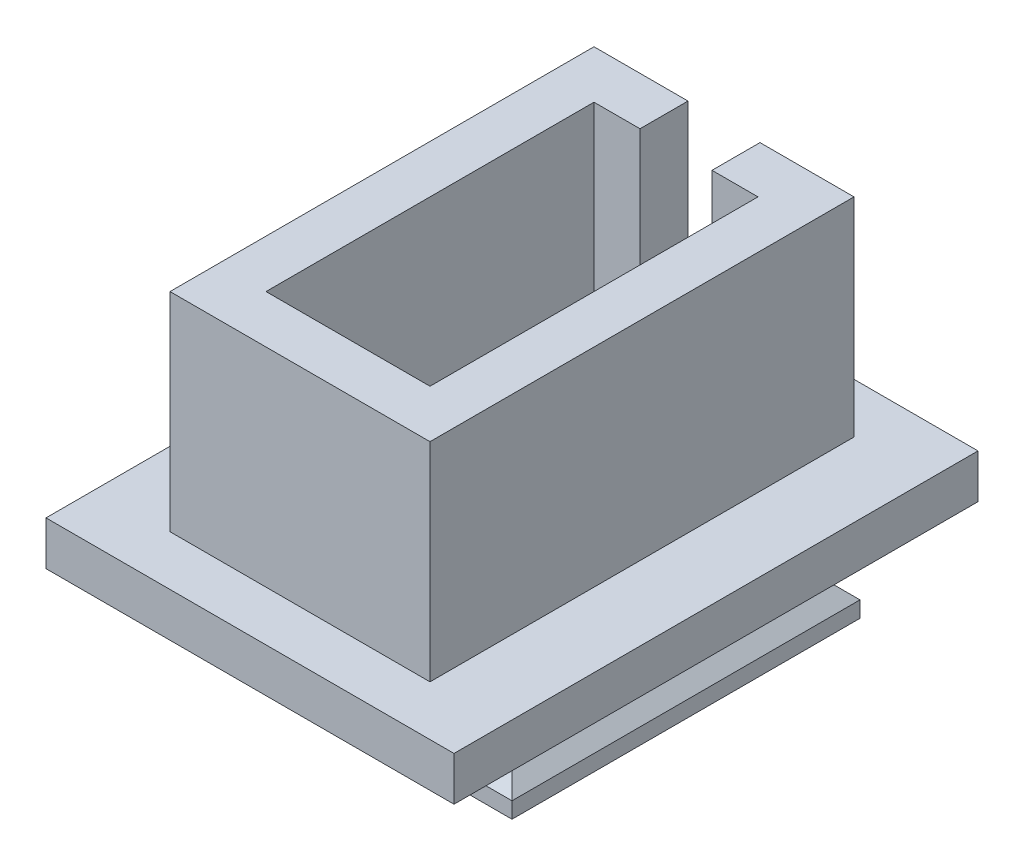
from build123d import *

# Parameters (mm, degrees)
SKETCH1_W           = 43.5
SKETCH1_H           = 43.5
BOSS_EXTRUDE1_DEPTH = 2
SKETCH2_W           = 43.5
SKETCH2_H           = 43.5
BOSS_EXTRUDE3_DEPTH = 7
CUT_EXTRUDE1_DEPTH  = 53.350416735
CUT_EXTRUDE2_DEPTH  = 52.039681144
SKETCH7_W           = 51
SKETCH7_H           = 65.5
BOSS_EXTRUDE4_DEPTH = 5.5
BOSS_EXTRUDE5_DEPTH = 26


with BuildPart() as part:
    # Sketch1 → Boss-Extrude1 (new body)
    with BuildSketch(Plane(origin=(0, 0, 0), x_dir=(1, 0, 0), z_dir=(0, 1, 0))):
        with Locations((-5.950471698, -3.385613208)):
            Rectangle(SKETCH1_W, SKETCH1_H)
    extrude(amount=BOSS_EXTRUDE1_DEPTH)


with BuildPart() as body_2:
    # Sketch2 → Boss-Extrude3 (new body)
    with BuildSketch(Plane(origin=(0, 2, 0), x_dir=(1, 0, 0), z_dir=(0, 1, 0))):
        with Locations((-5.950471698, -3.385613208)):
            Rectangle(SKETCH2_W, SKETCH2_H)
    extrude(amount=BOSS_EXTRUDE3_DEPTH)

    # Sketch5 → Cut-Extrude1 (cut, through all)
    with BuildSketch(Plane.XY.offset(25.135613208)):
        Polygon((15.799528302, 9), (8.799528302, 9), (15.799528302, 2), align=None)
        Polygon((-27.700471698, 9), (-27.700471698, 2), (-20.700471698, 9), align=None)
    extrude(amount=-CUT_EXTRUDE1_DEPTH, mode=Mode.SUBTRACT)

    # Sketch6 → Cut-Extrude2 (cut, through all)
    with BuildSketch(Plane(origin=(15.799528302, 0, 0), x_dir=(0, 0, -1), z_dir=(1, 0, 0))):
        Polygon((-25.135613208, 2), (-25.135613208, 9), (-18.135613208, 9), align=None)
        Polygon((18.364386792, 2), (18.364386792, 9), (11.364386792, 9), align=None)
    extrude(amount=-CUT_EXTRUDE2_DEPTH, mode=Mode.SUBTRACT)

    # Sketch7 → Boss-Extrude4 (add)
    with BuildSketch(Plane(origin=(0, 9, 0), x_dir=(1, 0, 0), z_dir=(0, 1, 0))):
        with Locations((-5.950471698, -3.385613208)):
            Rectangle(SKETCH7_W, SKETCH7_H)
    extrude(amount=BOSS_EXTRUDE4_DEPTH)

    # Sketch9 → Boss-Extrude5 (add)
    with BuildSketch(Plane(origin=(0, 14.5, 0), x_dir=(1, 0, 0), z_dir=(0, 1, 0))):
        Polygon((-22.200471698, 23.114386792), (-22.200471698, -29.885613208), (10.299528302, -29.885613208), (10.299528302, 23.114386792), (-1.450471698, 23.114386792), (-1.450471698, 17.114386792), (4.299528302, 17.114386792), (4.299528302, -23.885613208), (-16.200471698, -23.885613208), (-16.200471698, 17.114386792), (-10.450471698, 17.114386792), (-10.450471698, 23.114386792), align=None)
    extrude(amount=BOSS_EXTRUDE5_DEPTH)


solid = Compound([part.part, body_2.part])
